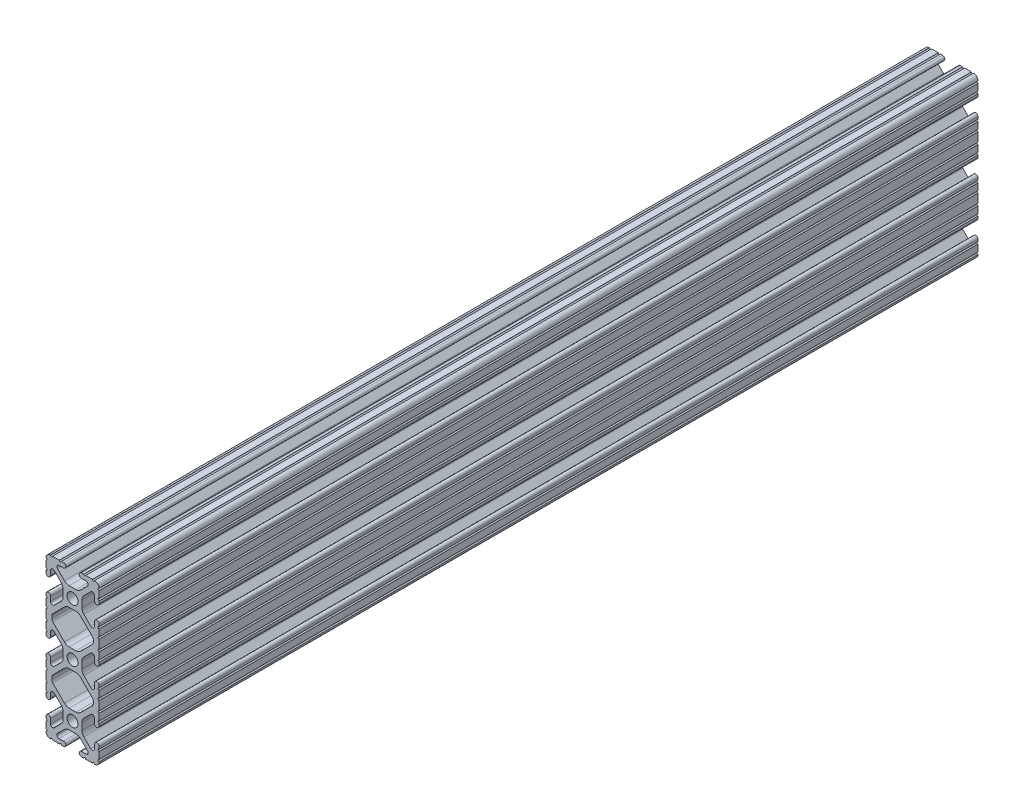
from build123d import *

# Parameters (mm, degrees)
SKETCH1_R           = 2.6035
BOSS_EXTRUDE1_DEPTH = 420.6875


with BuildPart() as part:
    # Sketch1 → Boss-Extrude1 (new body)
    with BuildSketch(Plane.XY):
        with BuildLine():
            Line((-6.3246, 38.1), (-9.5504, 38.1))
            ThreePointArc((-9.5504, 38.1), (-10.0584, 37.592), (-10.5664, 38.1))
            ThreePointArc((-10.5664, 38.1), (-12.082677406, 37.482677406), (-12.7, 35.9664))
            ThreePointArc((-12.7, 35.9664), (-12.192, 35.4584), (-12.7, 34.9504))
            Line((-12.7, 34.9504), (-12.7, 31.7246))
            ThreePointArc((-12.7, 31.7246), (-12.192, 31.2166), (-12.7, 30.7086))
            Line((-12.7, 30.7086), (-12.7, 29.702307889))
            ThreePointArc((-12.7, 29.702307889), (-11.5951, 28.597407889), (-10.4902, 29.702307889))
            Line((-10.4902, 29.702307889), (-10.4902, 31.874794456))
            ThreePointArc((-10.4902, 31.874794456), (-9.863006367, 32.813456061), (-8.75577951, 32.593214945))
            Line((-8.75577951, 32.593214945), (-5.43843597, 29.275871405))
            ThreePointArc((-5.43843597, 29.275871405), (-4.750182484, 28.245827272), (-4.5085, 27.030807374))
            Line((-4.5085, 27.030807374), (-4.5085, 23.769192626))
            ThreePointArc((-4.5085, 23.769192626), (-4.750182484, 22.554172728), (-5.43843597, 21.524128595))
            Line((-5.43843597, 21.524128595), (-8.75577951, 18.206785055))
            ThreePointArc((-8.75577951, 18.206785055), (-9.863006367, 17.986543939), (-10.4902, 18.925205544))
            Line((-10.4902, 18.925205544), (-10.4902, 21.097692111))
            ThreePointArc((-10.4902, 21.097692111), (-11.5951, 22.202592111), (-12.7, 21.097692111))
            Line((-12.7, 21.097692111), (-12.7, 20.0914))
            ThreePointArc((-12.7, 20.0914), (-12.192, 19.5834), (-12.7, 19.0754))
            Line((-12.7, 19.0754), (-12.7, 15.8496))
            ThreePointArc((-12.7, 15.8496), (-12.192, 15.3416), (-12.7, 14.8336))
            Line((-12.7, 14.8336), (-12.7, 10.5664))
            ThreePointArc((-12.7, 10.5664), (-12.192, 10.0584), (-12.7, 9.5504))
            Line((-12.7, 9.5504), (-12.7, 6.3246))
            ThreePointArc((-12.7, 6.3246), (-12.192, 5.8166), (-12.7, 5.3086))
            Line((-12.7, 5.3086), (-12.7, 4.302307889))
            ThreePointArc((-12.7, 4.302307889), (-11.5951, 3.197407889), (-10.4902, 4.302307889))
            Line((-10.4902, 4.302307889), (-10.4902, 6.474794456))
            ThreePointArc((-10.4902, 6.474794456), (-9.863006367, 7.413456061), (-8.75577951, 7.193214945))
            Line((-8.75577951, 7.193214945), (-5.43843597, 3.875871405))
            ThreePointArc((-5.43843597, 3.875871405), (-4.750182484, 2.845827272), (-4.5085, 1.630807374))
            Line((-4.5085, 1.630807374), (-4.5085, -1.630807374))
            ThreePointArc((-4.5085, -1.630807374), (-4.750182484, -2.845827272), (-5.43843597, -3.875871405))
            Line((-5.43843597, -3.875871405), (-8.75577951, -7.193214945))
            ThreePointArc((-8.75577951, -7.193214945), (-9.863006367, -7.413456061), (-10.4902, -6.474794456))
            Line((-10.4902, -6.474794456), (-10.4902, -4.302307889))
            ThreePointArc((-10.4902, -4.302307889), (-11.5951, -3.197407889), (-12.7, -4.302307889))
            Line((-12.7, -4.302307889), (-12.7, -5.3086))
            ThreePointArc((-12.7, -5.3086), (-12.192, -5.8166), (-12.7, -6.3246))
            Line((-12.7, -6.3246), (-12.7, -9.5504))
            ThreePointArc((-12.7, -9.5504), (-12.192, -10.0584), (-12.7, -10.5664))
            Line((-12.7, -10.5664), (-12.7, -14.8336))
            ThreePointArc((-12.7, -14.8336), (-12.192, -15.3416), (-12.7, -15.8496))
            Line((-12.7, -15.8496), (-12.7, -19.0754))
            ThreePointArc((-12.7, -19.0754), (-12.192, -19.5834), (-12.7, -20.0914))
            Line((-12.7, -20.0914), (-12.7, -21.097692111))
            ThreePointArc((-12.7, -21.097692111), (-11.5951, -22.202592111), (-10.4902, -21.097692111))
            Line((-10.4902, -21.097692111), (-10.4902, -18.925205544))
            ThreePointArc((-10.4902, -18.925205544), (-9.863006367, -17.986543939), (-8.75577951, -18.206785055))
            Line((-8.75577951, -18.206785055), (-5.43843597, -21.524128595))
            ThreePointArc((-5.43843597, -21.524128595), (-4.750182484, -22.554172728), (-4.5085, -23.769192626))
            Line((-4.5085, -23.769192626), (-4.5085, -27.030807374))
            ThreePointArc((-4.5085, -27.030807374), (-4.750182484, -28.245827272), (-5.43843597, -29.275871405))
            Line((-5.43843597, -29.275871405), (-8.75577951, -32.593214945))
            ThreePointArc((-8.75577951, -32.593214945), (-9.863006367, -32.813456061), (-10.4902, -31.874794456))
            Line((-10.4902, -31.874794456), (-10.4902, -29.702307889))
            ThreePointArc((-10.4902, -29.702307889), (-11.5951, -28.597407889), (-12.7, -29.702307889))
            Line((-12.7, -29.702307889), (-12.7, -30.7086))
            ThreePointArc((-12.7, -30.7086), (-12.192, -31.2166), (-12.7, -31.7246))
            Line((-12.7, -31.7246), (-12.7, -34.9504))
            ThreePointArc((-12.7, -34.9504), (-12.192, -35.4584), (-12.7, -35.9664))
            ThreePointArc((-12.7, -35.9664), (-12.082677406, -37.482677406), (-10.5664, -38.1))
            ThreePointArc((-10.5664, -38.1), (-10.0584, -37.592), (-9.5504, -38.1))
            Line((-9.5504, -38.1), (-6.3246, -38.1))
            ThreePointArc((-6.3246, -38.1), (-5.8166, -37.592), (-5.3086, -38.1))
            Line((-5.3086, -38.1), (-4.302307889, -38.1))
            ThreePointArc((-4.302307889, -38.1), (-3.197407889, -36.9951), (-4.302307889, -35.8902))
            Line((-4.302307889, -35.8902), (-6.474794456, -35.8902))
            ThreePointArc((-6.474794456, -35.8902), (-7.413456061, -35.263006367), (-7.193214945, -34.15577951))
            Line((-7.193214945, -34.15577951), (-3.875871405, -30.83843597))
            ThreePointArc((-3.875871405, -30.83843597), (-2.845827272, -30.150182484), (-1.630807374, -29.9085))
            Line((-1.630807374, -29.9085), (1.630807374, -29.9085))
            ThreePointArc((1.630807374, -29.9085), (2.845827272, -30.150182484), (3.875871405, -30.83843597))
            Line((3.875871405, -30.83843597), (7.193214945, -34.15577951))
            ThreePointArc((7.193214945, -34.15577951), (7.413456061, -35.263006367), (6.474794456, -35.8902))
            Line((6.474794456, -35.8902), (4.302307889, -35.8902))
            ThreePointArc((4.302307889, -35.8902), (3.197407889, -36.9951), (4.302307889, -38.1))
            Line((4.302307889, -38.1), (5.3086, -38.1))
            ThreePointArc((5.3086, -38.1), (5.8166, -37.592), (6.3246, -38.1))
            Line((6.3246, -38.1), (9.5504, -38.1))
            ThreePointArc((9.5504, -38.1), (10.0584, -37.592), (10.5664, -38.1))
            ThreePointArc((10.5664, -38.1), (12.082677406, -37.482677406), (12.7, -35.9664))
            ThreePointArc((12.7, -35.9664), (12.192, -35.4584), (12.7, -34.9504))
            Line((12.7, -34.9504), (12.7, -31.7246))
            ThreePointArc((12.7, -31.7246), (12.192, -31.2166), (12.7, -30.7086))
            Line((12.7, -30.7086), (12.7, -29.702307918))
            ThreePointArc((12.7, -29.702307918), (11.5951, -28.597407918), (10.4902, -29.702307918))
            Line((10.4902, -29.702307918), (10.4902, -31.874794456))
            ThreePointArc((10.4902, -31.874794456), (9.863006367, -32.813456061), (8.75577951, -32.593214945))
            Line((8.75577951, -32.593214945), (5.43843597, -29.275871405))
            ThreePointArc((5.43843597, -29.275871405), (4.750182484, -28.245827272), (4.5085, -27.030807374))
            Line((4.5085, -27.030807374), (4.5085, -23.769192626))
            ThreePointArc((4.5085, -23.769192626), (4.750182484, -22.554172728), (5.43843597, -21.524128595))
            Line((5.43843597, -21.524128595), (8.75577951, -18.206785055))
            ThreePointArc((8.75577951, -18.206785055), (9.863006367, -17.986543939), (10.4902, -18.925205544))
            Line((10.4902, -18.925205544), (10.4902, -21.097692058))
            ThreePointArc((10.4902, -21.097692058), (11.5951, -22.202592058), (12.7, -21.097692058))
            Line((12.7, -21.097692058), (12.7, -20.0914))
            ThreePointArc((12.7, -20.0914), (12.192, -19.5834), (12.7, -19.0754))
            Line((12.7, -19.0754), (12.7, -15.8496))
            ThreePointArc((12.7, -15.8496), (12.192, -15.3416), (12.7, -14.8336))
            Line((12.7, -14.8336), (12.7, -10.5664))
            ThreePointArc((12.7, -10.5664), (12.192, -10.0584), (12.7, -9.5504))
            Line((12.7, -9.5504), (12.7, -6.3246))
            ThreePointArc((12.7, -6.3246), (12.192, -5.8166), (12.7, -5.3086))
            Line((12.7, -5.3086), (12.7, -4.302307889))
            ThreePointArc((12.7, -4.302307889), (11.5951, -3.197407889), (10.4902, -4.302307889))
            Line((10.4902, -4.302307889), (10.4902, -6.474794456))
            ThreePointArc((10.4902, -6.474794456), (9.863006367, -7.413456061), (8.75577951, -7.193214945))
            Line((8.75577951, -7.193214945), (5.43843597, -3.875871405))
            ThreePointArc((5.43843597, -3.875871405), (4.750182484, -2.845827272), (4.5085, -1.630807374))
            Line((4.5085, -1.630807374), (4.5085, 1.630807374))
            ThreePointArc((4.5085, 1.630807374), (4.750182484, 2.845827272), (5.43843597, 3.875871405))
            Line((5.43843597, 3.875871405), (8.75577951, 7.193214945))
            ThreePointArc((8.75577951, 7.193214945), (9.863006367, 7.413456061), (10.4902, 6.474794456))
            Line((10.4902, 6.474794456), (10.4902, 4.302307889))
            ThreePointArc((10.4902, 4.302307889), (11.5951, 3.197407889), (12.7, 4.302307889))
            Line((12.7, 4.302307889), (12.7, 5.3086))
            ThreePointArc((12.7, 5.3086), (12.192, 5.8166), (12.7, 6.3246))
            Line((12.7, 6.3246), (12.7, 9.5504))
            ThreePointArc((12.7, 9.5504), (12.192, 10.0584), (12.7, 10.5664))
            Line((12.7, 10.5664), (12.7, 14.8336))
            ThreePointArc((12.7, 14.8336), (12.192, 15.3416), (12.7, 15.8496))
            Line((12.7, 15.8496), (12.7, 19.0754))
            ThreePointArc((12.7, 19.0754), (12.192, 19.5834), (12.7, 20.0914))
            Line((12.7, 20.0914), (12.7, 21.097692082))
            ThreePointArc((12.7, 21.097692082), (11.5951, 22.202592082), (10.4902, 21.097692082))
            Line((10.4902, 21.097692082), (10.4902, 18.925205544))
            ThreePointArc((10.4902, 18.925205544), (9.863006367, 17.986543939), (8.75577951, 18.206785055))
            Line((8.75577951, 18.206785055), (5.43843597, 21.524128595))
            ThreePointArc((5.43843597, 21.524128595), (4.750182484, 22.554172728), (4.5085, 23.769192626))
            Line((4.5085, 23.769192626), (4.5085, 27.030807374))
            ThreePointArc((4.5085, 27.030807374), (4.750182484, 28.245827272), (5.43843597, 29.275871405))
            Line((5.43843597, 29.275871405), (8.75577951, 32.593214945))
            ThreePointArc((8.75577951, 32.593214945), (9.863006367, 32.813456061), (10.4902, 31.874794456))
            Line((10.4902, 31.874794456), (10.4902, 29.702307889))
            ThreePointArc((10.4902, 29.702307889), (11.5951, 28.597407889), (12.7, 29.702307889))
            Line((12.7, 29.702307889), (12.7, 30.7086))
            ThreePointArc((12.7, 30.7086), (12.192, 31.2166), (12.7, 31.7246))
            Line((12.7, 31.7246), (12.7, 34.9504))
            ThreePointArc((12.7, 34.9504), (12.192, 35.4584), (12.7, 35.9664))
            ThreePointArc((12.7, 35.9664), (12.082677406, 37.482677406), (10.5664, 38.1))
            ThreePointArc((10.5664, 38.1), (10.0584, 37.592), (9.5504, 38.1))
            Line((9.5504, 38.1), (6.3246, 38.1))
            ThreePointArc((6.3246, 38.1), (5.8166, 37.592), (5.3086, 38.1))
            Line((5.3086, 38.1), (4.302307889, 38.1))
            ThreePointArc((4.302307889, 38.1), (3.197407889, 36.9951), (4.302307889, 35.8902))
            Line((4.302307889, 35.8902), (6.474794456, 35.8902))
            ThreePointArc((6.474794456, 35.8902), (7.413456061, 35.263006367), (7.193214945, 34.15577951))
            Line((7.193214945, 34.15577951), (3.875871405, 30.83843597))
            ThreePointArc((3.875871405, 30.83843597), (2.845827272, 30.150182484), (1.630807374, 29.9085))
            Line((1.630807374, 29.9085), (-1.630807374, 29.9085))
            ThreePointArc((-1.630807374, 29.9085), (-2.845827272, 30.150182484), (-3.875871405, 30.83843597))
            Line((-3.875871405, 30.83843597), (-7.193214945, 34.15577951))
            ThreePointArc((-7.193214945, 34.15577951), (-7.413456061, 35.263006367), (-6.474794456, 35.8902))
            Line((-6.474794456, 35.8902), (-4.302307889, 35.8902))
            ThreePointArc((-4.302307889, 35.8902), (-3.197407889, 36.9951), (-4.302307889, 38.1))
            Line((-4.302307889, 38.1), (-5.3086, 38.1))
            ThreePointArc((-5.3086, 38.1), (-5.8166, 37.592), (-6.3246, 38.1))
        make_face()
        with Locations(Location((0, 25.4, 0), (0, 0, 180))):
            Circle(SKETCH1_R, mode=Mode.SUBTRACT)
        with Locations(Location((0, -25.4, 0), (0, 0, 180))):
            Circle(SKETCH1_R, mode=Mode.SUBTRACT)
        with Locations(Location((0, 0, 0), (0, 0, 180))):
            Circle(SKETCH1_R, mode=Mode.SUBTRACT)
        with BuildLine():
            Line((-9.9314, 12.146268083), (-9.9314, 13.253731917))
            ThreePointArc((-9.9314, 13.253731917), (-9.811525488, 13.856381786), (-9.470151759, 14.367283676))
            Line((-9.470151759, 14.367283676), (-3.875871405, 19.96156403))
            ThreePointArc((-3.875871405, 19.96156403), (-2.845827272, 20.649817516), (-1.630807374, 20.8915))
            Line((-1.630807374, 20.8915), (1.630807374, 20.8915))
            ThreePointArc((1.630807374, 20.8915), (2.845827272, 20.649817516), (3.875871405, 19.96156403))
            Line((3.875871405, 19.96156403), (9.470151759, 14.367283676))
            ThreePointArc((9.470151759, 14.367283676), (9.811525488, 13.856381786), (9.9314, 13.253731917))
            Line((9.9314, 13.253731917), (9.9314, 12.146268083))
            ThreePointArc((9.9314, 12.146268083), (9.811525488, 11.543618214), (9.470151759, 11.032716324))
            Line((9.470151759, 11.032716324), (3.875871405, 5.43843597))
            ThreePointArc((3.875871405, 5.43843597), (2.845827272, 4.750182484), (1.630807374, 4.5085))
            Line((1.630807374, 4.5085), (-1.630807374, 4.5085))
            ThreePointArc((-1.630807374, 4.5085), (-2.845827272, 4.750182484), (-3.875871405, 5.43843597))
            Line((-3.875871405, 5.43843597), (-9.470151759, 11.032716324))
            ThreePointArc((-9.470151759, 11.032716324), (-9.811525488, 11.543618214), (-9.9314, 12.146268083))
        make_face(mode=Mode.SUBTRACT)
        with BuildLine():
            Line((-9.9314, -13.253731917), (-9.9314, -12.146268083))
            ThreePointArc((-9.9314, -12.146268083), (-9.811525488, -11.543618214), (-9.470151759, -11.032716324))
            Line((-9.470151759, -11.032716324), (-3.875871405, -5.43843597))
            ThreePointArc((-3.875871405, -5.43843597), (-2.845827272, -4.750182484), (-1.630807374, -4.5085))
            Line((-1.630807374, -4.5085), (1.630807374, -4.5085))
            ThreePointArc((1.630807374, -4.5085), (2.845827272, -4.750182484), (3.875871405, -5.43843597))
            Line((3.875871405, -5.43843597), (9.470151759, -11.032716324))
            ThreePointArc((9.470151759, -11.032716324), (9.811525488, -11.543618214), (9.9314, -12.146268083))
            Line((9.9314, -12.146268083), (9.9314, -13.253731917))
            ThreePointArc((9.9314, -13.253731917), (9.811525488, -13.856381786), (9.470151759, -14.367283676))
            Line((9.470151759, -14.367283676), (3.875871405, -19.96156403))
            ThreePointArc((3.875871405, -19.96156403), (2.845827272, -20.649817516), (1.630807374, -20.8915))
            Line((1.630807374, -20.8915), (-1.630807374, -20.8915))
            ThreePointArc((-1.630807374, -20.8915), (-2.845827272, -20.649817516), (-3.875871405, -19.96156403))
            Line((-3.875871405, -19.96156403), (-9.470151759, -14.367283676))
            ThreePointArc((-9.470151759, -14.367283676), (-9.811525488, -13.856381786), (-9.9314, -13.253731917))
        make_face(mode=Mode.SUBTRACT)
    extrude(amount=-BOSS_EXTRUDE1_DEPTH)


solid = part.part
